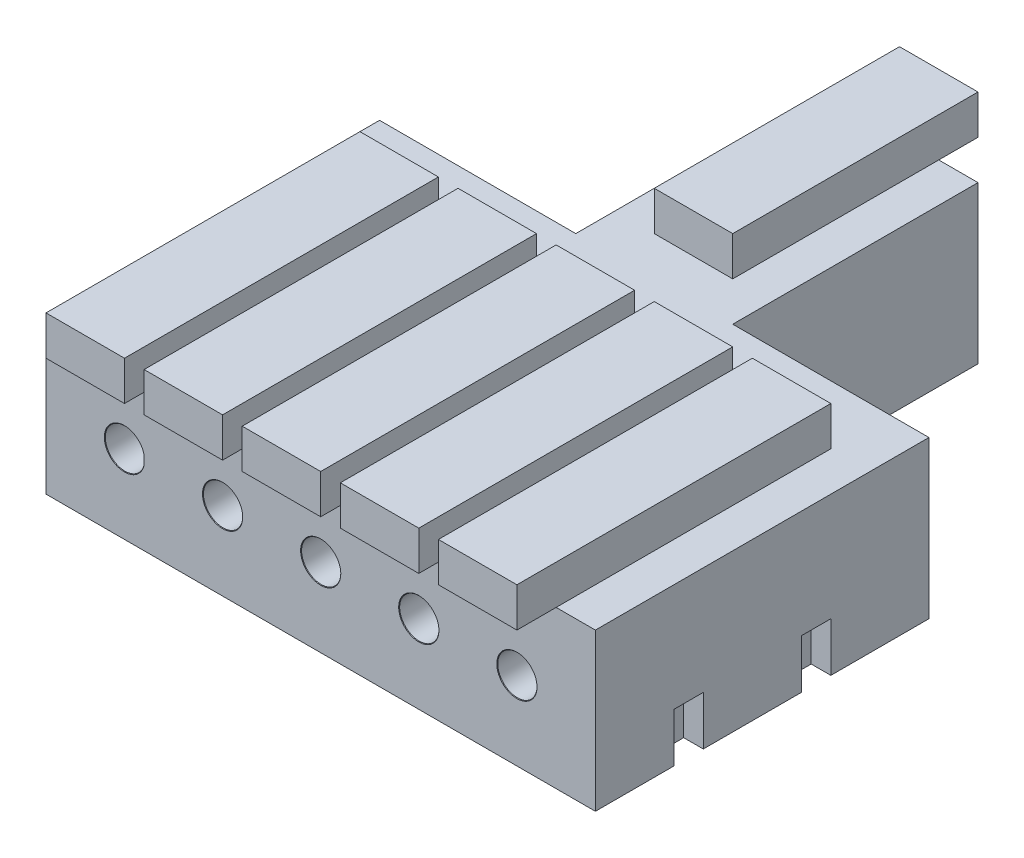
from build123d import *

# Parameters (mm, degrees)
SKETCH1_W                  = 8
SKETCH1_H                  = 17
CONNECTOR_BODY_DEPTH       = 8
SKETCH4_W                  = 4
SKETCH4_H                  = 16
CLAMP_DEPTH                = 2
CONNECTOR_PATTERN_COUNT    = 5
CONNECTOR_PATTERN_PITCH    = 5
SKETCH5_W                  = 8
SKETCH5_H                  = 12.5
SINGLE_BODY_DEPTH          = 8
SKETCH6_W                  = 1.5
SKETCH6_H                  = 2.500390225
CHAINING_NOBS_DEPTH        = 1
SKETCH7_W                  = 1
SKETCH7_H                  = 1.5
CHAINING_NOBS_CUTOUT_DEPTH = 2.50039
SKETCH8_W                  = 4
SKETCH8_H                  = 12.5
SINGLE_BODY_CLAMP_DEPTH    = 2
SKETCH9_R                  = 2.25
SKETCH9_R_2                = 1.5
MOUNTING_RINGS_DEPTH       = 2


with BuildPart() as part:
    # Sketch1 → connector_body (new body)
    with BuildSketch(Plane(origin=(0, 0, 0), x_dir=(1, 0, 0), z_dir=(0, 1, 0))):
        with Locations((4, 8.5)):
            Rectangle(SKETCH1_W, SKETCH1_H)
    connector_body = extrude(amount=CONNECTOR_BODY_DEPTH)

    # Sketch3 → cable_hole (revolve, cut)
    with BuildSketch(Plane(origin=(4, 4, 0), x_dir=(0, -1, 0), z_dir=(1, 0, 0))):
        Polygon((0, 0), (0, 10.600860619), (1, 10), (1, 0.025), (1.025, 0), align=None)
    cable_hole = revolve(axis=Axis((4, 4, 6.35), (0, 0, -1)), mode=Mode.SUBTRACT)

    # Sketch4 → clamp (add)
    with BuildSketch(Plane(origin=(0, 8, 0), x_dir=(1, 0, 0), z_dir=(0, 1, 0))):
        with Locations((4, 6)):
            Rectangle(SKETCH4_W, SKETCH4_H)
    clamp = extrude(amount=CLAMP_DEPTH)

    # connector_pattern: connector_body, cable_hole, clamp ×5
    with Locations(*[(i * CONNECTOR_PATTERN_PITCH, 0, 0) for i in range(1, CONNECTOR_PATTERN_COUNT)]):
        add(connector_body)
        add(cable_hole, mode=Mode.SUBTRACT)
        add(clamp)

    # Sketch5 → single_body (add)
    with BuildSketch(Plane(origin=(0, 8, 0), x_dir=(1, 0, 0), z_dir=(0, 1, 0))):
        with Locations((14, 23.25)):
            Rectangle(SKETCH5_W, SKETCH5_H)
    extrude(amount=-SINGLE_BODY_DEPTH)

    # Sketch6 → chaining_nobs (add)
    with BuildSketch(Plane.ZY):
        with Locations((-11.25, 1.250195113)):
            Rectangle(SKETCH6_W, SKETCH6_H)
        with Locations((-4.75, 1.250195113)):
            Rectangle(SKETCH6_W, SKETCH6_H)
    extrude(amount=CHAINING_NOBS_DEPTH)

    # Sketch7 → chaining_nobs_cutout (cut)
    with BuildSketch(Plane.XZ):
        with Locations((27.5, -4.75)):
            Rectangle(SKETCH7_W, SKETCH7_H)
        with Locations((27.5, -11.25)):
            Rectangle(SKETCH7_W, SKETCH7_H)
    extrude(amount=-CHAINING_NOBS_CUTOUT_DEPTH, mode=Mode.SUBTRACT)

    # Sketch8 → single_body_clamp (add)
    with BuildSketch(Plane(origin=(0, 8, 0), x_dir=(1, 0, 0), z_dir=(0, 1, 0))):
        with Locations((14, 25.25)):
            Rectangle(SKETCH8_W, SKETCH8_H)
    extrude(amount=SINGLE_BODY_CLAMP_DEPTH)

    # Sketch9 → mounting_rings (add)
    # profile 1 of 2: a face of its own
    with BuildSketch(Plane.XZ):
        with Locations((8, -19)):
            Circle(SKETCH9_R)
        with Locations(Location((8, -19, 0), (0, 0, 270))):
            Circle(SKETCH9_R_2, mode=Mode.SUBTRACT)
    # profile 2 of 2: a face of its own
    with BuildSketch(Plane.XZ):
        with Locations((20, -19)):
            Circle(SKETCH9_R)
        with Locations(Location((20, -19, 0), (0, 0, 270))):
            Circle(SKETCH9_R_2, mode=Mode.SUBTRACT)
    extrude(amount=-MOUNTING_RINGS_DEPTH)


solid = part.part
